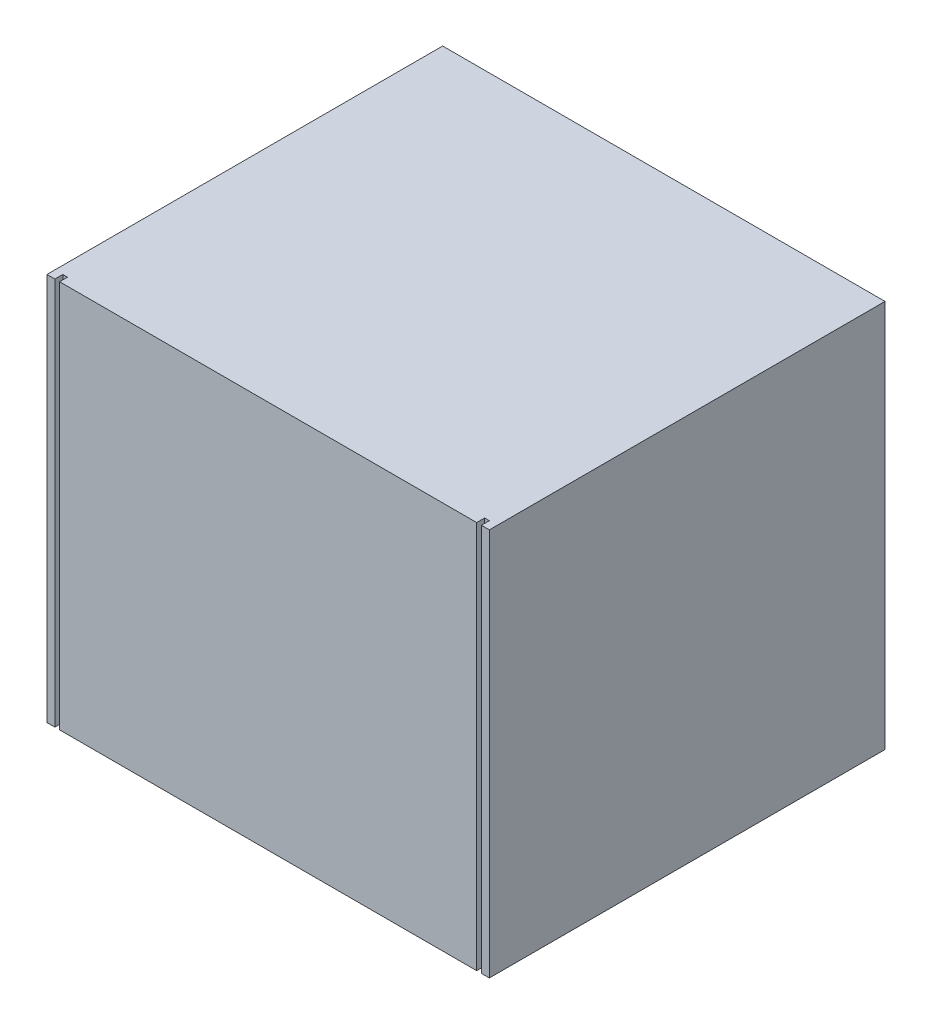
from build123d import *

# Parameters (mm, degrees)
SKETCH_2_W           = 559.015307906
SKETCH_2_H           = 680
EXTRUDE_2_DEPTH      = 400
SKETCH_3_OUTSIDE_W   = 754.395
SKETCH_3_OUTSIDE_H   = 875.38
SKETCH_3_OUTSIDE_W_2 = 559.015307906
SKETCH_3_OUTSIDE_H_2 = 490.432891875
CUT_EXTRUDE_1_DEPTH  = 784.744027655
SKETCH_4_W           = 559.015307906
SKETCH_4_H           = 490.432891875
EXTRUDE_3_DEPTH      = 100
SHELL_2_T            = -30
SKETCH_5_W           = 499.015307907
SKETCH_5_H           = 6
CUT_EXTRUDE_2_DEPTH  = 10
SKETCH_6_W           = 499.015307907
SKETCH_6_H           = 6
CUT_EXTRUDE_3_DEPTH  = 10
SKETCH_7_W           = 6
SKETCH_7_H           = 490.432891874
CUT_EXTRUDE_4_DEPTH  = 10


with BuildPart() as part:
    # 草图2 → 凸台-拉伸2 (new body)
    with BuildSketch(Plane(origin=(180.83794206, -79.035754343, 0), x_dir=(1, 0, 0), z_dir=(0, 0, 1))):
        with Locations((101.397699083, -216.026809528)):
            Rectangle(SKETCH_2_W, SKETCH_2_H)
    extrude(amount=EXTRUDE_2_DEPTH)

    # 草图3 outside → 切除-拉伸1 (cut, through all)
    with BuildSketch(Plane(origin=(180.83794206, -79.035754343, 400), x_dir=(1, 0, 0), z_dir=(0, 0, 1))):
        with Locations((101.3975, -216.027)):
            Rectangle(SKETCH_3_OUTSIDE_W, SKETCH_3_OUTSIDE_H)
        with Locations((101.397699083, -310.72828395)):
            Rectangle(SKETCH_3_OUTSIDE_W_2, SKETCH_3_OUTSIDE_H_2, mode=Mode.SUBTRACT)
    extrude(amount=-CUT_EXTRUDE_1_DEPTH, mode=Mode.SUBTRACT)

    # 草图4 → 凸台-拉伸3 (add)
    with BuildSketch(Plane(origin=(180.83794206, -79.035754343, 0), x_dir=(-1, 0, 0), z_dir=(0, 0, -1))):
        with Locations((-101.397699083, -310.72828395)):
            Rectangle(SKETCH_4_W, SKETCH_4_H)
    extrude(amount=EXTRUDE_3_DEPTH)

    # 抽壳2
    shell_2_openings = [part.faces().sort_by_distance(p)[0] for p in [
        (282.235641143, -389.764038294, -100),
    ]]
    offset(amount=SHELL_2_T, openings=shell_2_openings, kind=Kind.INTERSECTION)

    # 草图5 → 切除-拉伸2 (cut)
    with BuildSketch(Plane.XZ.offset(174.547592357)):
        with Locations((282.235641143, -87)):
            Rectangle(SKETCH_5_W, SKETCH_5_H)
    cut_extrude_2 = extrude(amount=-CUT_EXTRUDE_2_DEPTH, mode=Mode.SUBTRACT)

    # 草图6 → 切除-拉伸3 (cut)
    with BuildSketch(Plane.XZ.offset(174.547592357)):
        with Locations((282.235641143, -76)):
            Rectangle(SKETCH_6_W, SKETCH_6_H)
    cut_extrude_3 = extrude(amount=-CUT_EXTRUDE_3_DEPTH, mode=Mode.SUBTRACT)

    # 镜向1: 切除-拉伸2, 切除-拉伸3 across plane
    add(cut_extrude_2.mirror(Plane(origin=(0, -389.764038294, 0), x_dir=(0, 0, 1), z_dir=(0, -1, 0))), mode=Mode.SUBTRACT)
    add(cut_extrude_3.mirror(Plane(origin=(0, -389.764038294, 0), x_dir=(0, 0, 1), z_dir=(0, -1, 0))), mode=Mode.SUBTRACT)

    # 草图7 → 切除-拉伸4 (cut)
    with BuildSketch(Plane.XY.offset(400)):
        with Locations((548.743295096, -389.764038294)):
            Rectangle(SKETCH_7_W, SKETCH_7_H)
    cut_extrude_4 = extrude(amount=-CUT_EXTRUDE_4_DEPTH, mode=Mode.SUBTRACT)

    # 镜向2: 切除-拉伸4 across plane
    add(cut_extrude_4.mirror(Plane.ZY.offset(-282.235641143)), mode=Mode.SUBTRACT)


solid = part.part
